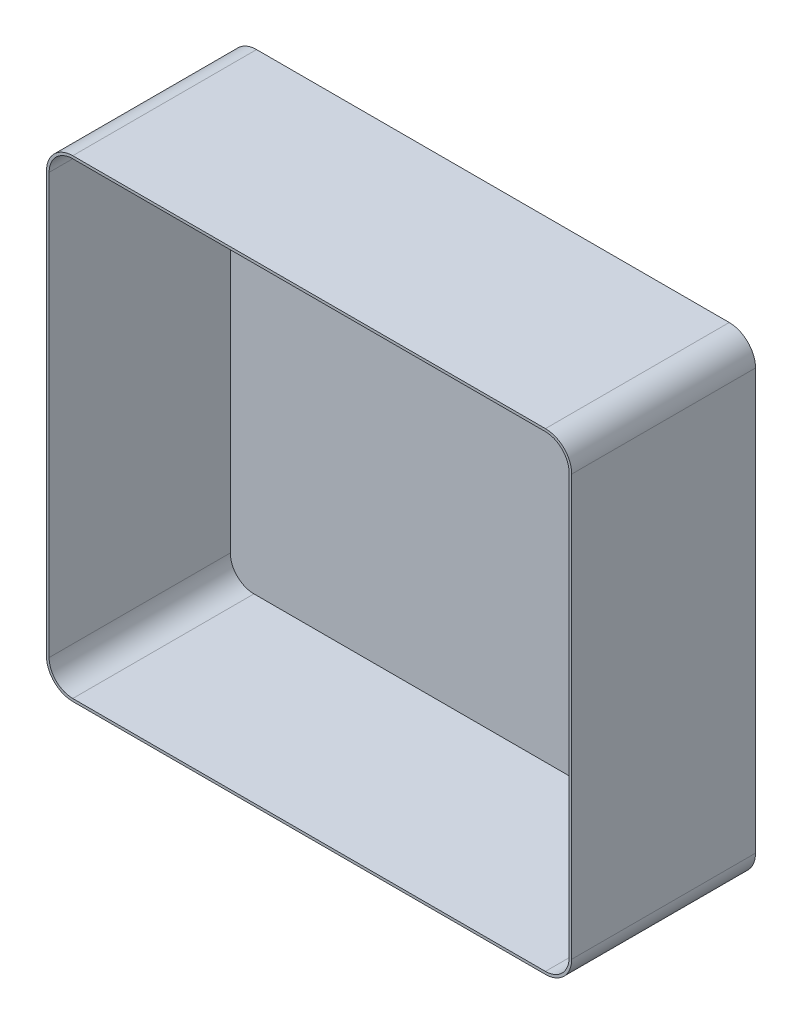
from build123d import *

# Parameters (mm, degrees)
EXTRUDE_1_DEPTH = 70
SHELL_1_T       = -1


with BuildPart() as part:
    # 草图1 → 凸台-拉伸1 (new body)
    with BuildSketch(Plane.XY):
        with BuildLine():
            Line((-90, -90), (90, -90))
            ThreePointArc((90, -90), (97.071067812, -87.071067812), (100, -80))
            Line((100, -80), (100, 80))
            ThreePointArc((100, 80), (97.071067812, 87.071067812), (90, 90))
            Line((90, 90), (-90, 90))
            ThreePointArc((-90, 90), (-97.071067812, 87.071067812), (-100, 80))
            Line((-100, 80), (-100, -80))
            ThreePointArc((-100, -80), (-97.071067812, -87.071067812), (-90, -90))
        make_face()
    extrude(amount=EXTRUDE_1_DEPTH)

    # 抽壳1
    shell_1_openings = [part.faces().sort_by_distance(p)[0] for p in [
        (0, 0, 70),
    ]]
    offset(amount=SHELL_1_T, openings=shell_1_openings, kind=Kind.INTERSECTION)


solid = part.part
